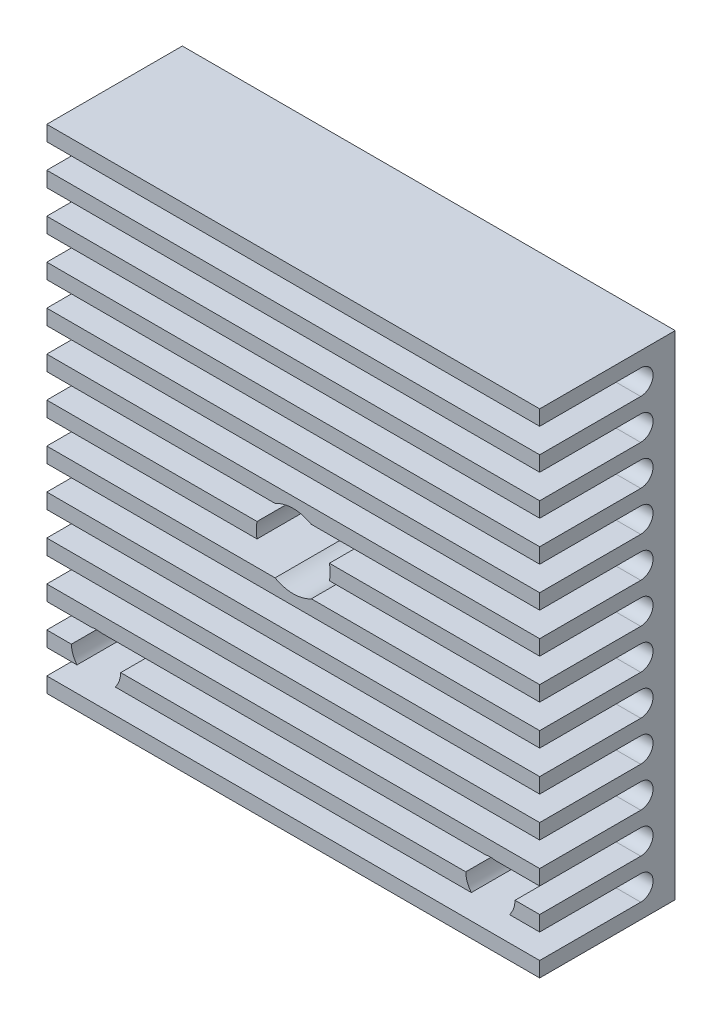
from build123d import *

# Parameters (mm, degrees)
SKETCH1_W           = 40
SKETCH1_H           = 40
BOSS_EXTRUDE1_DEPTH = 11
CUT_EXTRUDE1_DEPTH  = 47.054315759
SKETCH4_R           = 2
SKETCH4_R_2         = 3
CUT_EXTRUDE2_DEPTH  = 31.347981811


with BuildPart() as part:
    # Sketch1 → Boss-Extrude1 (new body)
    with BuildSketch(Plane.XY):
        Rectangle(SKETCH1_W, SKETCH1_H)
    extrude(amount=BOSS_EXTRUDE1_DEPTH)

    # Sketch3 → Cut-Extrude1 (cut, through all)
    with BuildSketch(Plane(origin=(20, 0, 0), x_dir=(0, 0, -1), z_dir=(1, 0, 0))):
        with BuildLine():
            Line((-11, -18.769), (-11, -16.769))
            Line((-11, -16.769), (-2.8, -16.769))
            ThreePointArc((-2.8, -16.769), (-1.8, -17.769), (-2.8, -18.769))
            Line((-2.8, -18.769), (-11, -18.769))
        make_face()
        with BuildLine():
            Line((-2.8, -13.538), (-11, -13.538))
            Line((-11, -13.538), (-11, -15.538))
            Line((-11, -15.538), (-2.8, -15.538))
            ThreePointArc((-2.8, -15.538), (-1.8, -14.538), (-2.8, -13.538))
        make_face()
        with BuildLine():
            Line((-2.8, -10.307), (-11, -10.307))
            Line((-11, -10.307), (-11, -12.307))
            Line((-11, -12.307), (-2.8, -12.307))
            ThreePointArc((-2.8, -12.307), (-1.8, -11.307), (-2.8, -10.307))
        make_face()
        with BuildLine():
            Line((-2.8, -7.076), (-11, -7.076))
            Line((-11, -7.076), (-11, -9.076))
            Line((-11, -9.076), (-2.8, -9.076))
            ThreePointArc((-2.8, -9.076), (-1.8, -8.076), (-2.8, -7.076))
        make_face()
        with BuildLine():
            Line((-2.8, -3.845), (-11, -3.845))
            Line((-11, -3.845), (-11, -5.845))
            Line((-11, -5.845), (-2.8, -5.845))
            ThreePointArc((-2.8, -5.845), (-1.8, -4.845), (-2.8, -3.845))
        make_face()
        with BuildLine():
            Line((-2.8, -0.614), (-11, -0.614))
            Line((-11, -0.614), (-11, -2.614))
            Line((-11, -2.614), (-2.8, -2.614))
            ThreePointArc((-2.8, -2.614), (-1.8, -1.614), (-2.8, -0.614))
        make_face()
        with BuildLine():
            Line((-2.8, 2.617), (-11, 2.617))
            Line((-11, 2.617), (-11, 0.617))
            Line((-11, 0.617), (-2.8, 0.617))
            ThreePointArc((-2.8, 0.617), (-1.8, 1.617), (-2.8, 2.617))
        make_face()
        with BuildLine():
            Line((-2.8, 5.848), (-11, 5.848))
            Line((-11, 5.848), (-11, 3.848))
            Line((-11, 3.848), (-2.8, 3.848))
            ThreePointArc((-2.8, 3.848), (-1.8, 4.848), (-2.8, 5.848))
        make_face()
        with BuildLine():
            Line((-2.8, 9.079), (-11, 9.079))
            Line((-11, 9.079), (-11, 7.079))
            Line((-11, 7.079), (-2.8, 7.079))
            ThreePointArc((-2.8, 7.079), (-1.8, 8.079), (-2.8, 9.079))
        make_face()
        with BuildLine():
            Line((-2.8, 12.31), (-11, 12.31))
            Line((-11, 12.31), (-11, 10.31))
            Line((-11, 10.31), (-2.8, 10.31))
            ThreePointArc((-2.8, 10.31), (-1.8, 11.31), (-2.8, 12.31))
        make_face()
        with BuildLine():
            Line((-2.8, 15.541), (-11, 15.541))
            Line((-11, 15.541), (-11, 13.541))
            Line((-11, 13.541), (-2.8, 13.541))
            ThreePointArc((-2.8, 13.541), (-1.8, 14.541), (-2.8, 15.541))
        make_face()
        with BuildLine():
            Line((-2.8, 18.772), (-11, 18.772))
            Line((-11, 18.772), (-11, 16.772))
            Line((-11, 16.772), (-2.8, 16.772))
            ThreePointArc((-2.8, 16.772), (-1.8, 17.772), (-2.8, 18.772))
        make_face()
    extrude(amount=-CUT_EXTRUDE1_DEPTH, mode=Mode.SUBTRACT)

    # Sketch4 → Cut-Extrude2 (cut, through all)
    with BuildSketch(Plane(origin=(0, 0, 0), x_dir=(-1, 0, 0), z_dir=(0, 0, -1))):
        with Locations((16, -15.5)):
            Circle(SKETCH4_R)
        with Locations((-16, -15.5)):
            Circle(SKETCH4_R)
        Circle(SKETCH4_R_2)
    extrude(amount=-CUT_EXTRUDE2_DEPTH, mode=Mode.SUBTRACT)


solid = part.part
